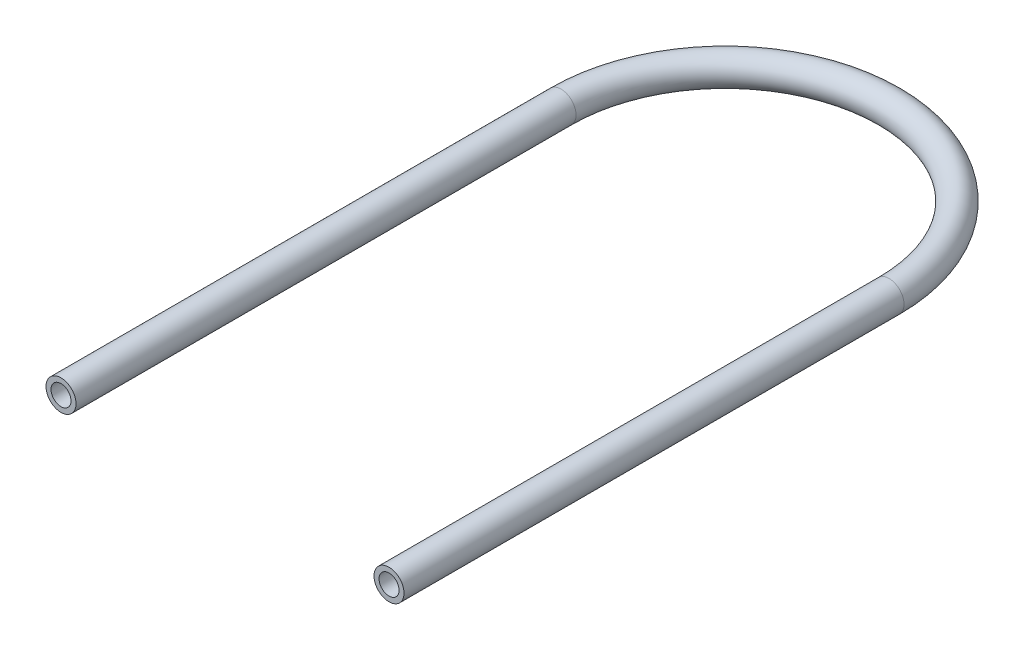
from build123d import *

# Parameters (mm, degrees)
SKETCH2_R   = 1.5
SKETCH2_R_2 = 1


with BuildPart() as part:
    # Sweep1: sweep along a path in Sketch1
    with BuildLine(Plane(origin=(0, 0, 0), x_dir=(1, 0, 0), z_dir=(0, 1, 0))) as sweep1_path:
        Line((-41.788235294, -18.235294118), (-41.788235294, 31.764705882))
        ThreePointArc((-41.788235294, 31.764705882), (-25.388235294, 48.164705882), (-8.988235294, 31.764705882))
        Line((-8.988235294, 31.764705882), (-8.988235294, -18.235294118))
    # Sketch2 → Sweep1 (sweep)
    with BuildSketch(Plane(origin=(-41.788235294, 0, 18.235294118), x_dir=(-1, 0, 0), z_dir=(0, 0, -1))):
        Circle(SKETCH2_R)
        Circle(SKETCH2_R_2, mode=Mode.SUBTRACT)
    sweep(path=sweep1_path.line)


solid = part.part
